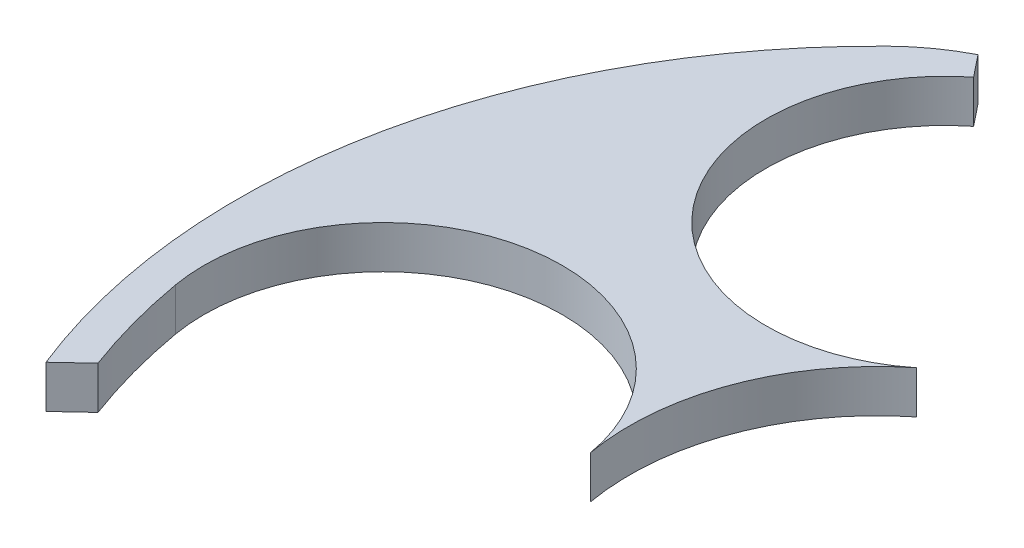
from build123d import *

# Parameters (mm, degrees)
BOSS_EXTRU_1_DEPTH = 5


with BuildPart() as part:
    # Esquisse1 → Boss.-Extru.1 (new body)
    with BuildSketch(Plane(origin=(0, 0, 0), x_dir=(1, 0, 0), z_dir=(0, 1, 0))):
        with BuildLine():
            ThreePointArc((-68.670306383, 42.279177512), (-89.686678349, 4.155942482), (-85.987250464, -39.218971617))
            Line((-85.987250464, -39.218971617), (-82.83716136, -36.273074377))
            ThreePointArc((-82.83716136, -36.273074377), (-84.826823628, -30.09859374), (-86.244619049, -23.768283856))
            ThreePointArc((-86.244619049, -23.768283856), (-69.212709026, 0.560999754), (-44.883425416, -16.470910269))
            ThreePointArc((-44.883425416, -16.470910269), (-43.446659296, -1.166342783), (-34.389436177, 11.253834034))
            ThreePointArc((-34.389436177, 11.253834034), (-63.898789522, 14.600185058), (-60.552438498, 44.109538403))
            Line((-60.552438498, 44.109538403), (-62.574572693, 46.648950451))
            ThreePointArc((-62.574572693, 46.648950451), (-65.787242564, 44.693960448), (-68.670306383, 42.279177512))
        make_face()
    extrude(amount=BOSS_EXTRU_1_DEPTH)


solid = part.part
